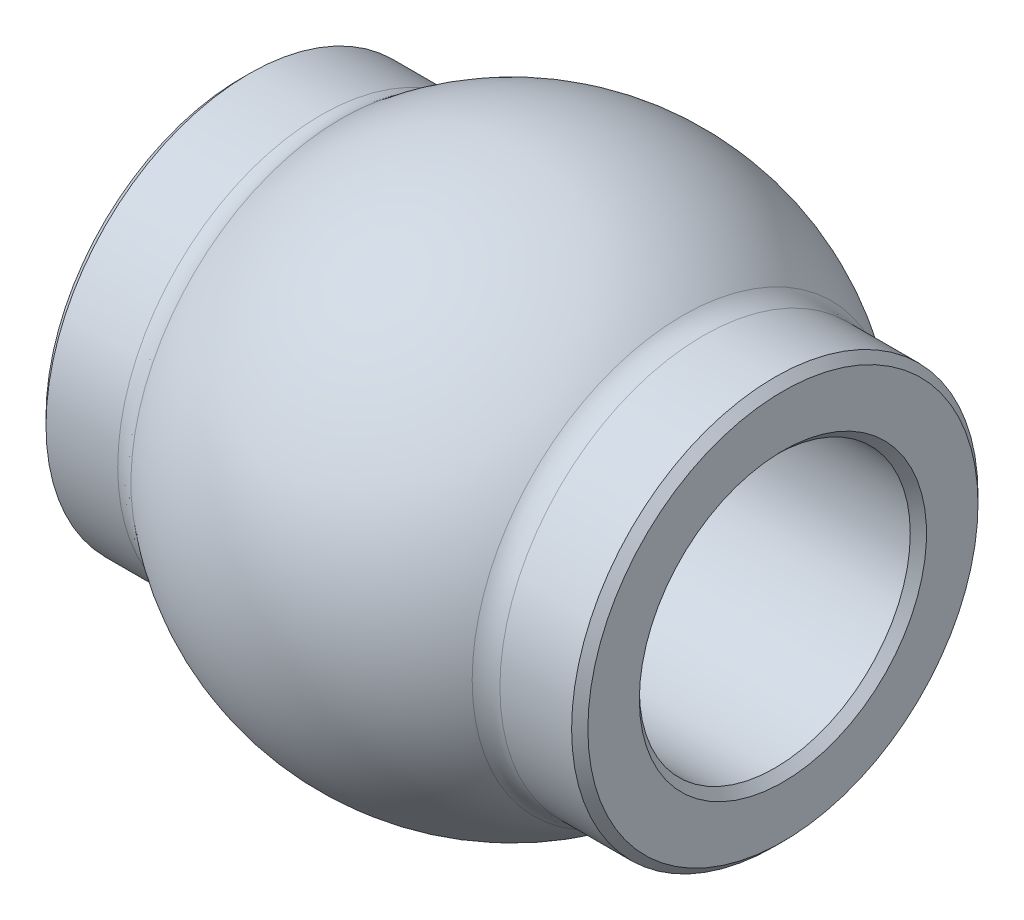
from build123d import *

# Parameters (mm, degrees)
CUT_EXTRUDE1_DEPTH      = 22.997045256
CUT_EXTRUDE1_DEPTH_BACK = 22.997045256
SKETCH2_R               = 6.35
FILLET1_R               = 1.524
CHAMFER1_SIZE           = 0.381


with BuildPart() as part:
    # Sketch1 → Revolve1 (revolve)
    with BuildSketch(Plane.XY):
        with BuildLine():
            Line((-12.7, 0), (12.7, 0))
            Line((12.7, 0), (12.7, 9.525))
            Line((12.7, 9.525), (8.400260413, 9.525))
            ThreePointArc((8.400260413, 9.525), (0, 12.7), (-8.400260413, 9.525))
            Line((-8.400260413, 9.525), (-12.7, 9.525))
            Line((-12.7, 9.525), (-12.7, 0))
        make_face()
    revolve(axis=Axis((-19.734173111, 0, 0), (1, 0, 0)))

    # Sketch2 → Cut-Extrude1 (cut, two sides: drawn at the far end of the back side and taken through both)
    with BuildSketch(Plane(origin=(0, 0, 0), x_dir=(0, 0, -1), z_dir=(1, 0, 0)).offset(-CUT_EXTRUDE1_DEPTH_BACK)):
        Circle(SKETCH2_R)
    extrude(amount=CUT_EXTRUDE1_DEPTH + CUT_EXTRUDE1_DEPTH_BACK, mode=Mode.SUBTRACT)

    # Fillet1
    fillet1_edges = [part.edges().sort_by_distance(p)[0] for p in [
        (8.400260413, -9.525, 0),
        (-8.400260413, -9.525, 0),
    ]]
    fillet(fillet1_edges, radius=FILLET1_R)

    # Chamfer1
    chamfer1_edges = [part.edges().sort_by_distance(p)[0] for p in [
        (12.7, -9.525, 0),
        (-12.7, -9.525, 0),
        (12.7, 0, 6.35),
        (-12.7, 0, 6.35),
    ]]
    chamfer(chamfer1_edges, length=CHAMFER1_SIZE)


solid = part.part
